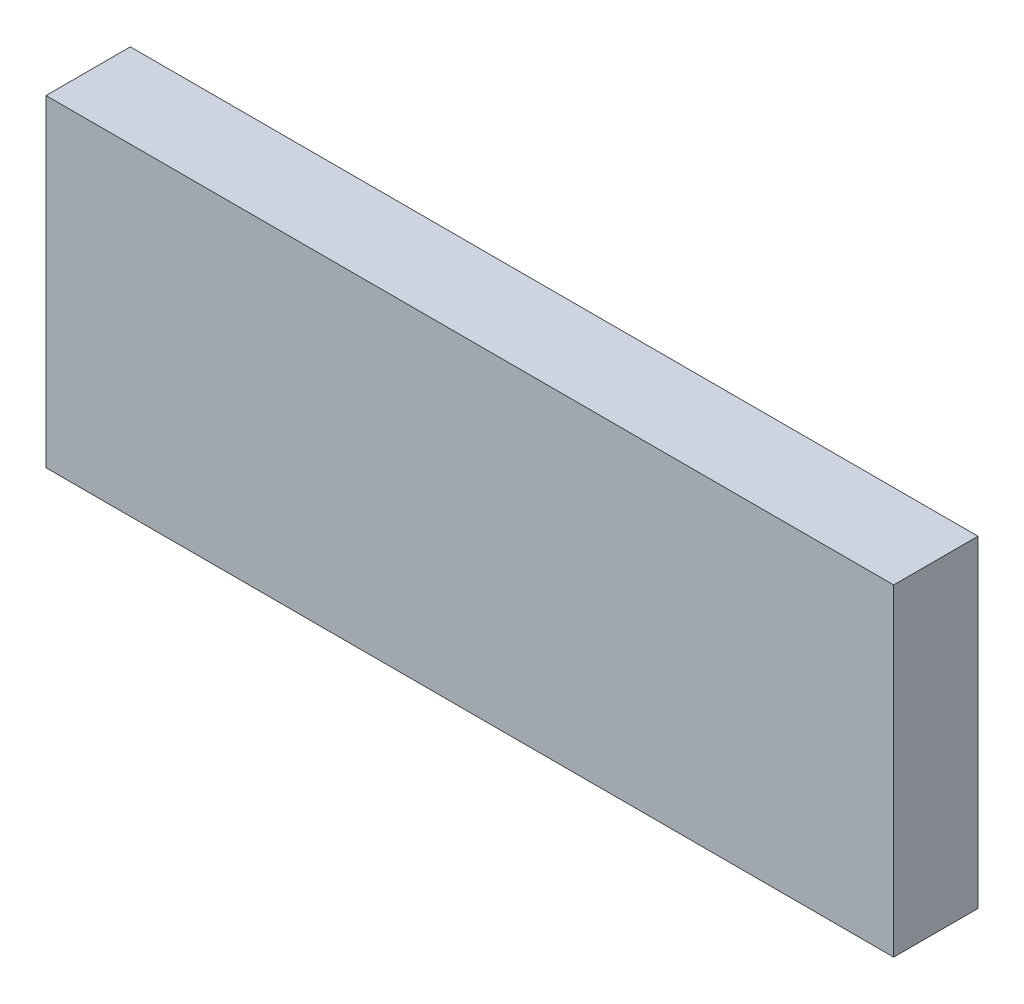
from build123d import *

# Parameters (mm, degrees)
ESBO_O1_W                = 96.5
ESBO_O1_H                = 36.7
RESSALTO_EXTRUS_O1_DEPTH = 4.8


with BuildPart() as part:
    # Esboço1 → Ressalto-extrusão1 (new, symmetric)
    with BuildSketch(Plane.XY):
        Rectangle(ESBO_O1_W, ESBO_O1_H)
    extrude(amount=RESSALTO_EXTRUS_O1_DEPTH, both=True)


solid = part.part
